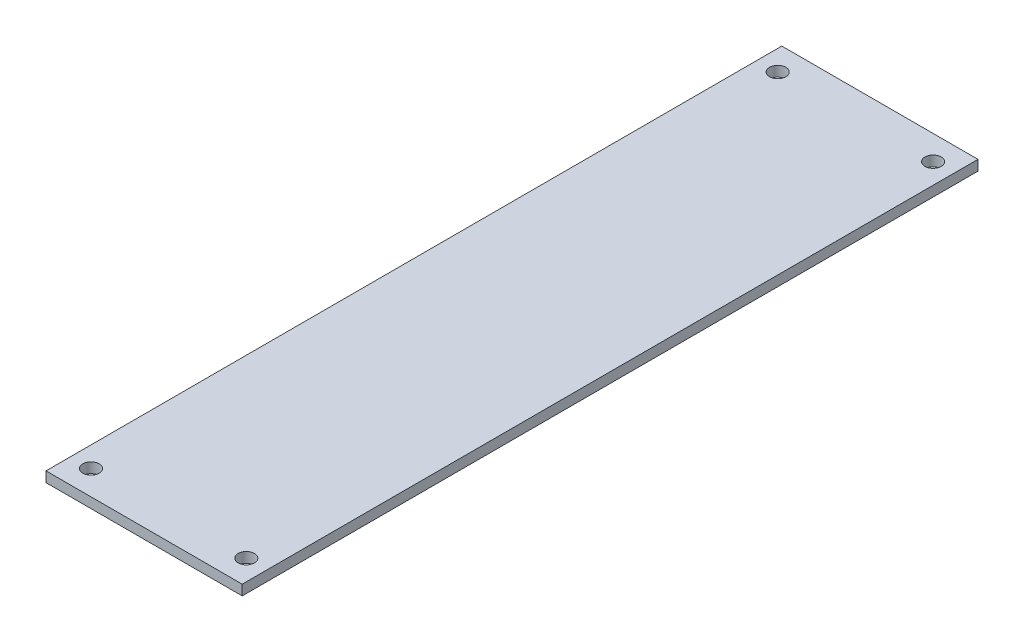
from build123d import *

# Parameters (mm, degrees)
SKETCH1_W           = 60.96
SKETCH1_H           = 228.6
BOSS_EXTRUDE1_DEPTH = 3.175
SKETCH2_R           = 2.54
CUT_EXTRUDE1_DEPTH  = 119.336811792


with BuildPart() as part:
    # Sketch1 → Boss-Extrude1 (new body)
    with BuildSketch(Plane(origin=(0, 0, 0), x_dir=(1, 0, 0), z_dir=(0, 1, 0))):
        Rectangle(SKETCH1_W, SKETCH1_H)
    extrude(amount=BOSS_EXTRUDE1_DEPTH)

    # Sketch2 → Cut-Extrude1 (cut, through all)
    with BuildSketch(Plane(origin=(0, 3.175, 0), x_dir=(1, 0, 0), z_dir=(0, 1, 0))):
        with Locations(Location((24.13, 106.68, 0), (0, 0, 270))):
            Circle(SKETCH2_R)
        with Locations(Location((-24.13, 106.68, 0), (0, 0, 270))):
            Circle(SKETCH2_R)
        with Locations(Location((-24.13, -106.68, 0), (0, 0, 270))):
            Circle(SKETCH2_R)
        with Locations(Location((24.13, -106.68, 0), (0, 0, 270))):
            Circle(SKETCH2_R)
    extrude(amount=-CUT_EXTRUDE1_DEPTH, mode=Mode.SUBTRACT)


solid = part.part
